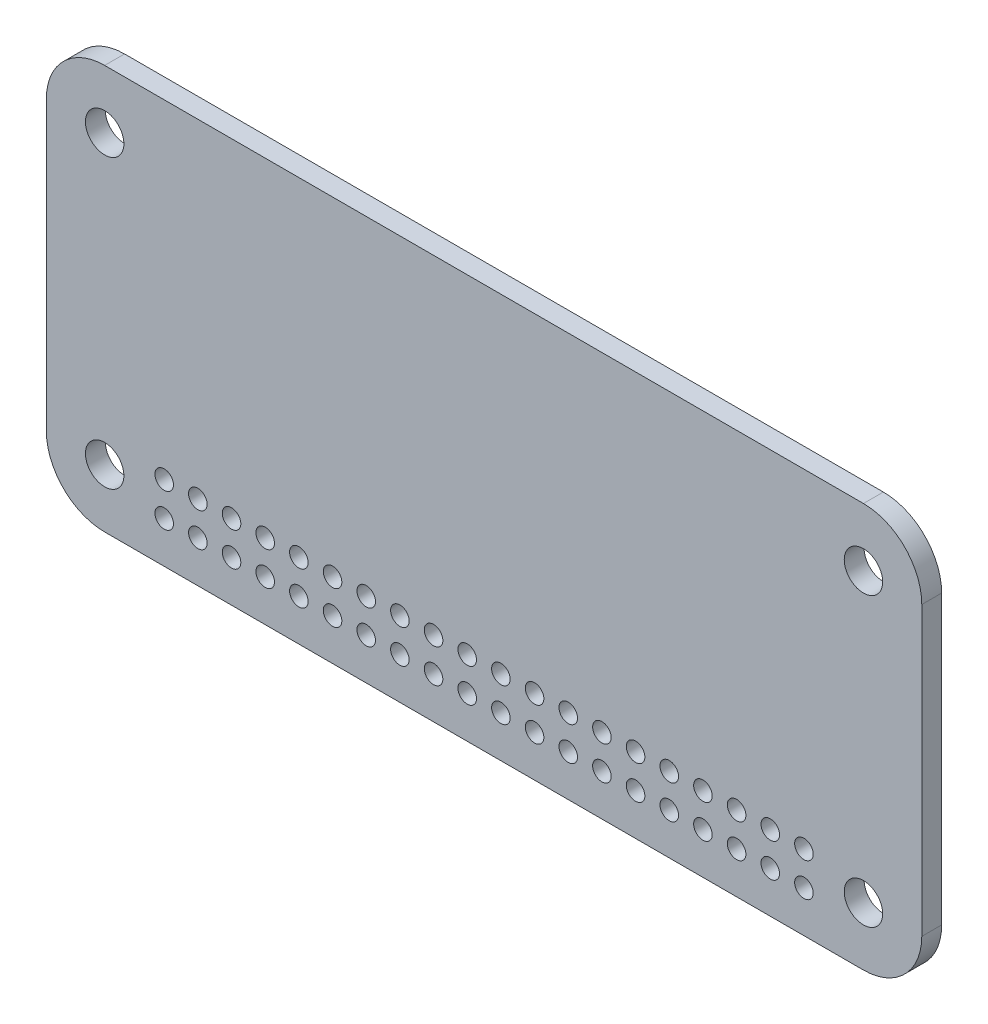
from build123d import *

# Parameters (mm, degrees)
CROQUIS1_R              = 1.45
CROQUIS1_R_2            = 0.7
SALIENTE_EXTRUIR1_DEPTH = 1.5


with BuildPart() as part:
    # Croquis1 → Saliente-Extruir1 (new body)
    with BuildSketch(Plane.XY):
        with BuildLine():
            Line((28.62, -15.24), (-28.62, -15.24))
            ThreePointArc((-28.62, -15.24), (-31.731269837, -13.951269837), (-33.02, -10.84))
            Line((-33.02, -10.84), (-33.02, 10.84))
            ThreePointArc((-33.02, 10.84), (-31.731269837, 13.951269837), (-28.62, 15.24))
            Line((-28.62, 15.24), (28.62, 15.24))
            ThreePointArc((28.62, 15.24), (31.731269837, 13.951269837), (33.02, 10.84))
            Line((33.02, 10.84), (33.02, -10.84))
            ThreePointArc((33.02, -10.84), (31.731269837, -13.951269837), (28.62, -15.24))
        make_face()
        with Locations((-28.62, 10.84)):
            Circle(CROQUIS1_R, mode=Mode.SUBTRACT)
        with Locations(Location((28.62, 10.84, 0), (0, 0, 180))):
            Circle(CROQUIS1_R, mode=Mode.SUBTRACT)
        with Locations((28.62, -10.84)):
            Circle(CROQUIS1_R, mode=Mode.SUBTRACT)
        with Locations(Location((-28.62, -10.84, 0), (0, 0, 180))):
            Circle(CROQUIS1_R, mode=Mode.SUBTRACT)
        with Locations((-24.13, -9.57)):
            Circle(CROQUIS1_R_2, mode=Mode.SUBTRACT)
        with Locations((-24.13, -12.11)):
            Circle(CROQUIS1_R_2, mode=Mode.SUBTRACT)
        with Locations((-21.59, -9.57)):
            Circle(CROQUIS1_R_2, mode=Mode.SUBTRACT)
        with Locations((-21.59, -12.11)):
            Circle(CROQUIS1_R_2, mode=Mode.SUBTRACT)
        with Locations((-19.05, -9.57)):
            Circle(CROQUIS1_R_2, mode=Mode.SUBTRACT)
        with Locations((-19.05, -12.11)):
            Circle(CROQUIS1_R_2, mode=Mode.SUBTRACT)
        with Locations((-16.51, -9.57)):
            Circle(CROQUIS1_R_2, mode=Mode.SUBTRACT)
        with Locations((-16.51, -12.11)):
            Circle(CROQUIS1_R_2, mode=Mode.SUBTRACT)
        with Locations((-13.97, -9.57)):
            Circle(CROQUIS1_R_2, mode=Mode.SUBTRACT)
        with Locations((-13.97, -12.11)):
            Circle(CROQUIS1_R_2, mode=Mode.SUBTRACT)
        with Locations((-11.43, -9.57)):
            Circle(CROQUIS1_R_2, mode=Mode.SUBTRACT)
        with Locations((-11.43, -12.11)):
            Circle(CROQUIS1_R_2, mode=Mode.SUBTRACT)
        with Locations((-8.89, -9.57)):
            Circle(CROQUIS1_R_2, mode=Mode.SUBTRACT)
        with Locations((-8.89, -12.11)):
            Circle(CROQUIS1_R_2, mode=Mode.SUBTRACT)
        with Locations((-6.35, -9.57)):
            Circle(CROQUIS1_R_2, mode=Mode.SUBTRACT)
        with Locations((-6.35, -12.11)):
            Circle(CROQUIS1_R_2, mode=Mode.SUBTRACT)
        with Locations((-3.81, -9.57)):
            Circle(CROQUIS1_R_2, mode=Mode.SUBTRACT)
        with Locations((-3.81, -12.11)):
            Circle(CROQUIS1_R_2, mode=Mode.SUBTRACT)
        with Locations((-1.27, -9.57)):
            Circle(CROQUIS1_R_2, mode=Mode.SUBTRACT)
        with Locations((-1.27, -12.11)):
            Circle(CROQUIS1_R_2, mode=Mode.SUBTRACT)
        with Locations((1.27, -9.57)):
            Circle(CROQUIS1_R_2, mode=Mode.SUBTRACT)
        with Locations((1.27, -12.11)):
            Circle(CROQUIS1_R_2, mode=Mode.SUBTRACT)
        with Locations((3.81, -9.57)):
            Circle(CROQUIS1_R_2, mode=Mode.SUBTRACT)
        with Locations((3.81, -12.11)):
            Circle(CROQUIS1_R_2, mode=Mode.SUBTRACT)
        with Locations((6.35, -9.57)):
            Circle(CROQUIS1_R_2, mode=Mode.SUBTRACT)
        with Locations((6.35, -12.11)):
            Circle(CROQUIS1_R_2, mode=Mode.SUBTRACT)
        with Locations((8.89, -9.57)):
            Circle(CROQUIS1_R_2, mode=Mode.SUBTRACT)
        with Locations((8.89, -12.11)):
            Circle(CROQUIS1_R_2, mode=Mode.SUBTRACT)
        with Locations((11.43, -9.57)):
            Circle(CROQUIS1_R_2, mode=Mode.SUBTRACT)
        with Locations((11.43, -12.11)):
            Circle(CROQUIS1_R_2, mode=Mode.SUBTRACT)
        with Locations((13.97, -9.57)):
            Circle(CROQUIS1_R_2, mode=Mode.SUBTRACT)
        with Locations((13.97, -12.11)):
            Circle(CROQUIS1_R_2, mode=Mode.SUBTRACT)
        with Locations((16.51, -9.57)):
            Circle(CROQUIS1_R_2, mode=Mode.SUBTRACT)
        with Locations((16.51, -12.11)):
            Circle(CROQUIS1_R_2, mode=Mode.SUBTRACT)
        with Locations((19.05, -9.57)):
            Circle(CROQUIS1_R_2, mode=Mode.SUBTRACT)
        with Locations((19.05, -12.11)):
            Circle(CROQUIS1_R_2, mode=Mode.SUBTRACT)
        with Locations((21.59, -9.57)):
            Circle(CROQUIS1_R_2, mode=Mode.SUBTRACT)
        with Locations((21.59, -12.11)):
            Circle(CROQUIS1_R_2, mode=Mode.SUBTRACT)
        with Locations((24.13, -9.57)):
            Circle(CROQUIS1_R_2, mode=Mode.SUBTRACT)
        with Locations((24.13, -12.11)):
            Circle(CROQUIS1_R_2, mode=Mode.SUBTRACT)
    extrude(amount=SALIENTE_EXTRUIR1_DEPTH)


solid = part.part
